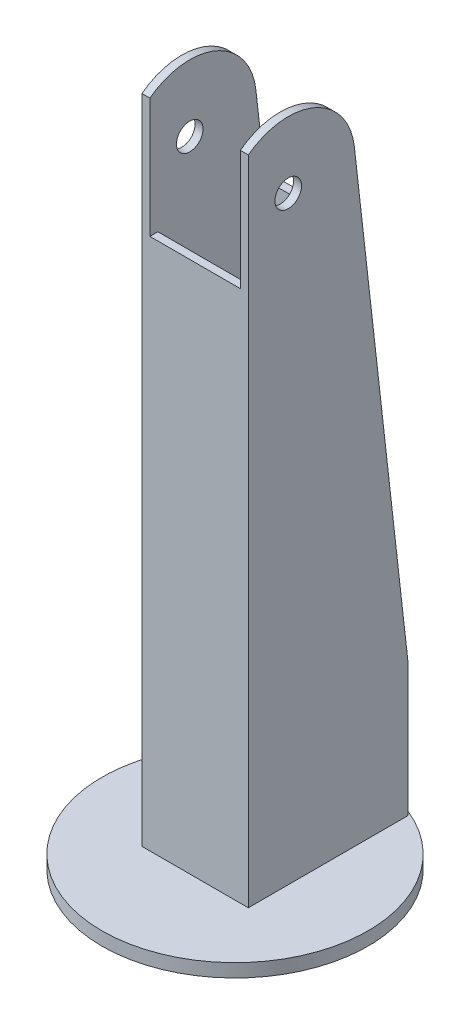
from build123d import *

# Parameters (mm, degrees)
CROQUIS1_W              = 40
CROQUIS1_H              = 60
SALIENTE_EXTRUIR1_DEPTH = 250
CROQUIS2_W              = 34
CROQUIS2_H              = 60
CORTAR_EXTRUIR1_DEPTH   = 50
CROQUIS3_R              = 5
CORTAR_EXTRUIR2_DEPTH   = 255.95097568
CORTAR_EXTRUIR5_DEPTH   = 255.95097568
CROQUIS6_R              = 50
SALIENTE_EXTRUIR2_DEPTH = 5
CROQUIS7_W              = 34
CROQUIS7_H              = 36.99441271
CORTAR_EXTRUIR6_DEPTH   = 221.794021658


with BuildPart() as part:
    # Croquis1 → Saliente-Extruir1 (new body)
    with BuildSketch(Plane(origin=(0, 0, 0), x_dir=(1, 0, 0), z_dir=(0, 1, 0))):
        Rectangle(CROQUIS1_W, CROQUIS1_H)
    extrude(amount=SALIENTE_EXTRUIR1_DEPTH)

    # Croquis2 → Cortar-Extruir1 (cut)
    with BuildSketch(Plane(origin=(0, 250, 0), x_dir=(1, 0, 0), z_dir=(0, 1, 0))):
        Rectangle(CROQUIS2_W, CROQUIS2_H)
    extrude(amount=-CORTAR_EXTRUIR1_DEPTH, mode=Mode.SUBTRACT)

    # Croquis3 → Cortar-Extruir2 (cut, through all)
    with BuildSketch(Plane(origin=(20, 0, 0), x_dir=(0, 0, -1), z_dir=(1, 0, 0))):
        with Locations((-15, 225)):
            Circle(CROQUIS3_R)
    extrude(amount=-CORTAR_EXTRUIR2_DEPTH, mode=Mode.SUBTRACT)

    # Croquis5 → Cortar-Extruir5 (cut, through all)
    with BuildSketch(Plane(origin=(20, 0, 0), x_dir=(0, 0, -1), z_dir=(1, 0, 0))):
        with BuildLine():
            Line((9.840871205, 227.816224024), (30, 50))
            Line((30, 50), (30, 250))
            Line((30, 250), (-15.00000011, 250))
            ThreePointArc((-15.00000011, 250), (1.652243042, 243.646790653), (9.840871205, 227.816224024))
        make_face()
        with BuildLine():
            ThreePointArc((-30, 245), (-22.905694203, 248.717082434), (-15.00000011, 250))
            Line((-15.00000011, 250), (-30, 250))
            Line((-30, 250), (-30, 245))
        make_face()
    extrude(amount=-CORTAR_EXTRUIR5_DEPTH, mode=Mode.SUBTRACT)

    # Croquis6 → Saliente-Extruir2 (add)
    with BuildSketch(Plane.XZ):
        with Locations(Location((0, 15, 0), (0, 0, 270))):
            Circle(CROQUIS6_R)
    extrude(amount=SALIENTE_EXTRUIR2_DEPTH)

    # Croquis7 → Cortar-Extruir6 (cut, through all)
    with BuildSketch(Plane(origin=(0, 200, 0), x_dir=(1, 0, 0), z_dir=(0, 1, 0))):
        with Locations((0, -8.502793645)):
            Rectangle(CROQUIS7_W, CROQUIS7_H)
    extrude(amount=-CORTAR_EXTRUIR6_DEPTH, mode=Mode.SUBTRACT)


solid = part.part
